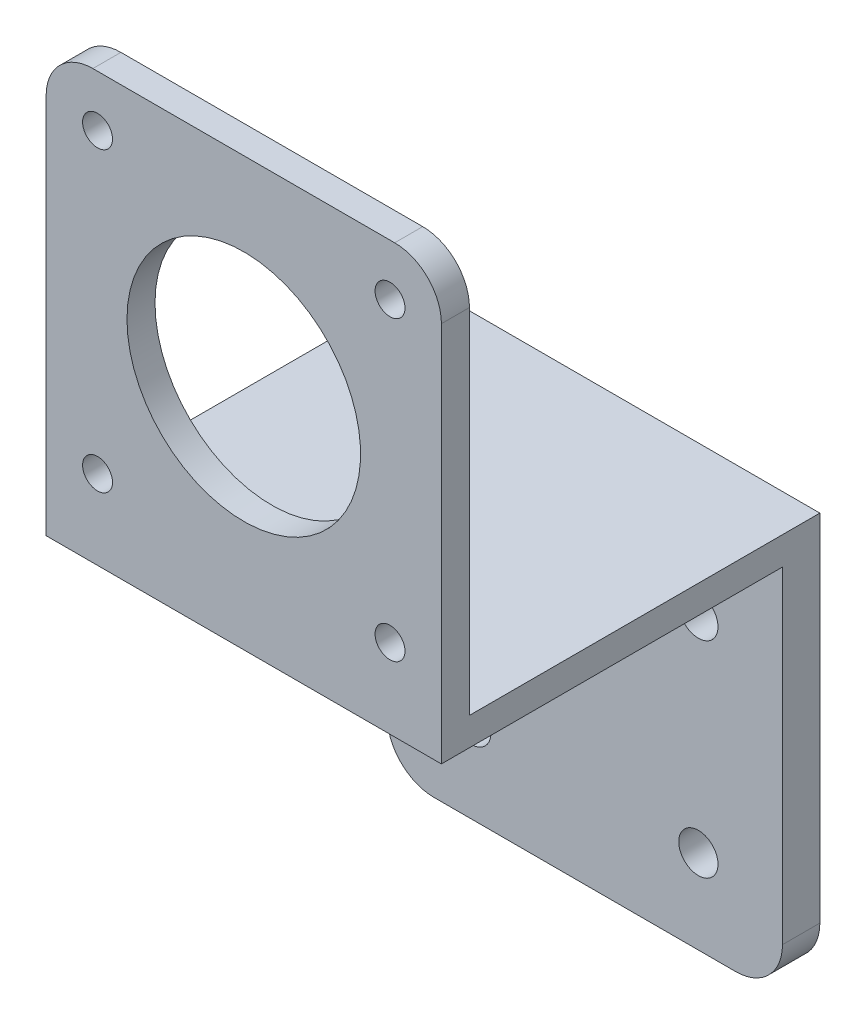
from build123d import *

# Parameters (mm, degrees)
SKETCH1_W           = 42.3
SKETCH1_H           = 42.8
BOSS_EXTRUDE1_DEPTH = 3
SKETCH6_R           = 12.5
SKETCH6_R_2         = 1.6
CUT_EXTRUDE3_DEPTH  = 31.237104689
SKETCH7_W           = 42.3
SKETCH7_H           = 40.5
BOSS_EXTRUDE2_DEPTH = 3
SKETCH8_W           = 42.3
SKETCH8_H           = 4
BOSS_EXTRUDE3_DEPTH = 40
SKETCH10_R          = 2.1
CUT_EXTRUDE4_DEPTH  = 77.986573505
FILLET1_R           = 5


with BuildPart() as part:
    # Sketch1 → Boss-Extrude1 (new body)
    with BuildSketch(Plane.XY):
        Rectangle(SKETCH1_W, SKETCH1_H)
    extrude(amount=BOSS_EXTRUDE1_DEPTH)

    # Sketch6 → Cut-Extrude3 (cut, through all)
    with BuildSketch(Plane(origin=(0, 0, 0), x_dir=(-1, 0, 0), z_dir=(0, 0, -1))):
        Circle(SKETCH6_R)
        with Locations((-15.65, 15.9)):
            Circle(SKETCH6_R_2)
        with Locations((15.65, 15.9)):
            Circle(SKETCH6_R_2)
        with Locations((-15.65, -15.9)):
            Circle(SKETCH6_R_2)
        with Locations((15.65, -15.9)):
            Circle(SKETCH6_R_2)
    extrude(amount=-CUT_EXTRUDE3_DEPTH, mode=Mode.SUBTRACT)

    # Sketch7 → Boss-Extrude2 (add)
    with BuildSketch(Plane.XZ.offset(21.4)):
        with Locations((0, -17.25)):
            Rectangle(SKETCH7_W, SKETCH7_H)
    extrude(amount=BOSS_EXTRUDE2_DEPTH)

    # Sketch8 → Boss-Extrude3 (add)
    with BuildSketch(Plane.XZ.offset(24.4)):
        with Locations((0, -35.5)):
            Rectangle(SKETCH8_W, SKETCH8_H)
    extrude(amount=BOSS_EXTRUDE3_DEPTH)

    # Sketch10 → Cut-Extrude4 (cut, through all)
    with BuildSketch(Plane.XY.offset(-33.5)):
        with Locations((-12.15, -33.4)):
            Circle(SKETCH10_R)
        with Locations((12.15, -33.4)):
            Circle(SKETCH10_R)
        with Locations((-12.15, -55.4)):
            Circle(SKETCH10_R)
        with Locations((12.15, -55.4)):
            Circle(SKETCH10_R)
    extrude(amount=-CUT_EXTRUDE4_DEPTH, mode=Mode.SUBTRACT)

    # Fillet1
    fillet1_edges = [part.edges().sort_by_distance(p)[0] for p in [
        (-21.15, -64.4, -35.5),
        (21.15, -64.4, -35.5),
        (-21.15, 21.4, 1.5),
        (21.15, 21.4, 1.5),
    ]]
    fillet(fillet1_edges, radius=FILLET1_R)


solid = part.part
